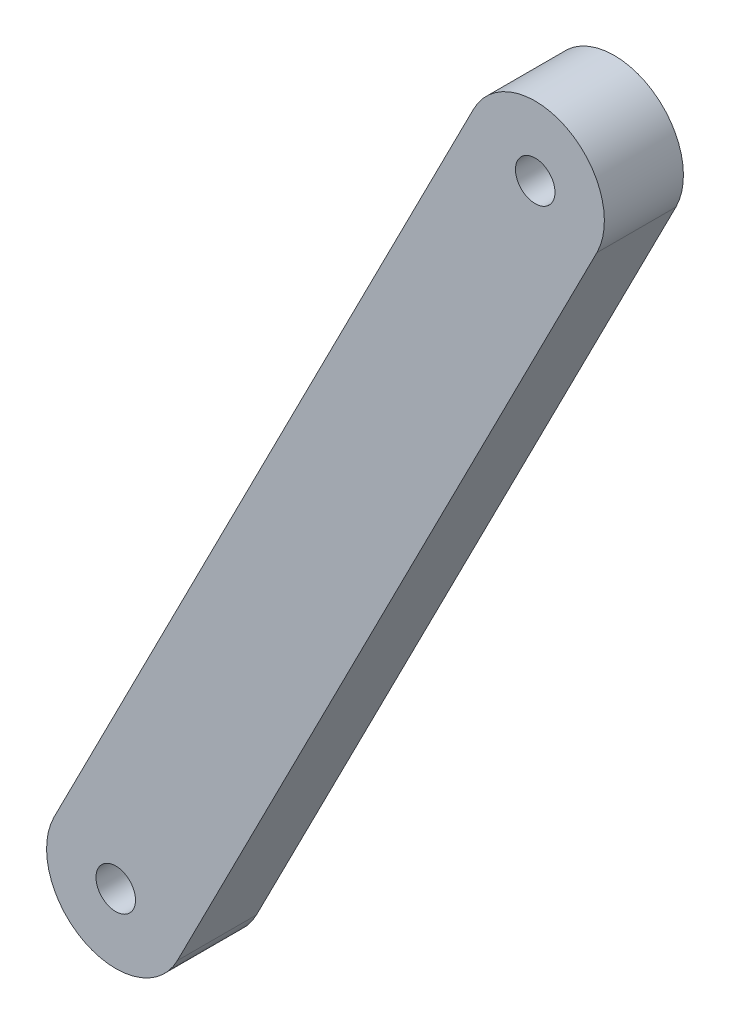
from build123d import *

# Parameters (mm, degrees)
SKETCH1_R           = 1
BOSS_EXTRUDE1_DEPTH = 4


with BuildPart() as part:
    # Sketch1 → Boss-Extrude1 (new body)
    with BuildSketch(Plane.XY):
        with BuildLine():
            Line((-3.118143687, 1.589710648), (18.111165137, 43.230015044))
            ThreePointArc((18.111165137, 43.230015044), (22.819019472, 44.758448083), (24.347452511, 40.050593747))
            Line((24.347452511, 40.050593747), (3.118143687, -1.589710648))
            ThreePointArc((3.118143687, -1.589710648), (-1.589710648, -3.118143687), (-3.118143687, 1.589710648))
        make_face()
        with Locations((21.229308824, 41.640304396)):
            Circle(SKETCH1_R, mode=Mode.SUBTRACT)
        Circle(SKETCH1_R, mode=Mode.SUBTRACT)
    extrude(amount=BOSS_EXTRUDE1_DEPTH)


solid = part.part
